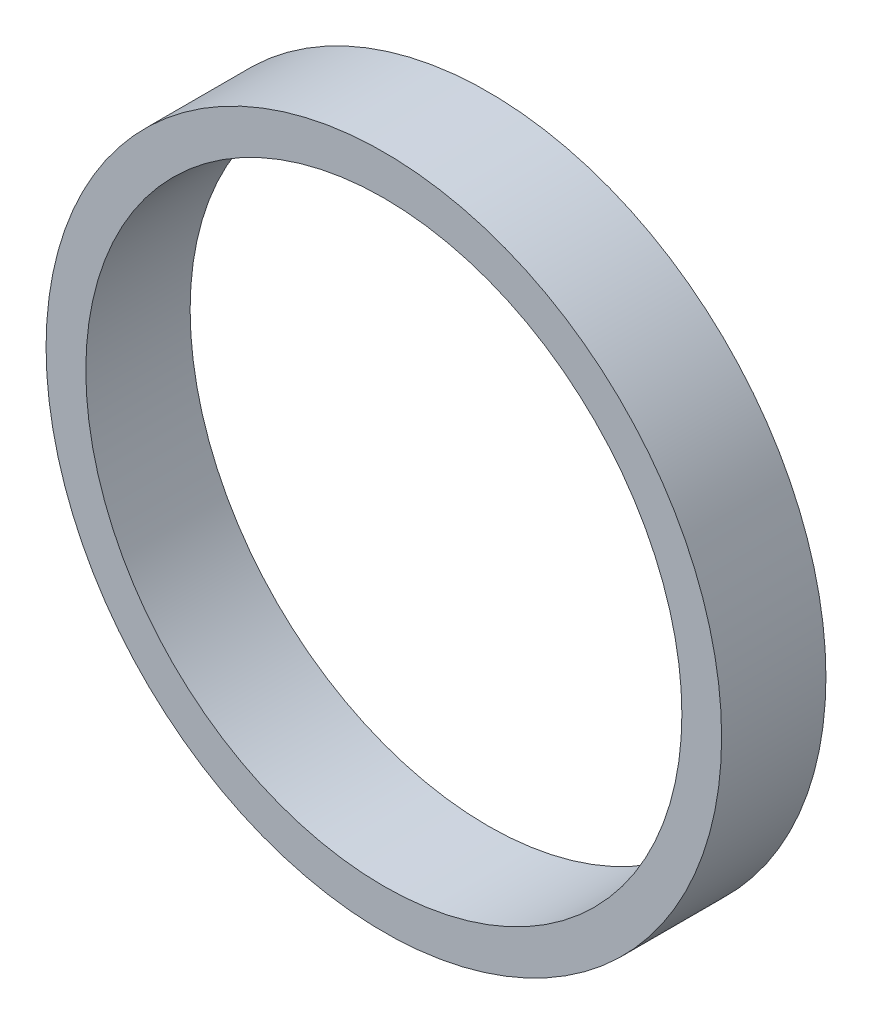
from build123d import *

# Parameters (mm, degrees)
SKETCH_1_R      = 34
SKETCH_1_R_2    = 30
EXTRUDE_1_DEPTH = 10.5


with BuildPart() as part:
    # 草图1 → 凸台-拉伸1 (new body)
    with BuildSketch(Plane.XY):
        with Locations(Location((0, 0, 0), (0, 0, 180))):
            Circle(SKETCH_1_R)
        with Locations(Location((0, 0, 0), (0, 0, 180))):
            Circle(SKETCH_1_R_2, mode=Mode.SUBTRACT)
    extrude(amount=EXTRUDE_1_DEPTH)


solid = part.part
